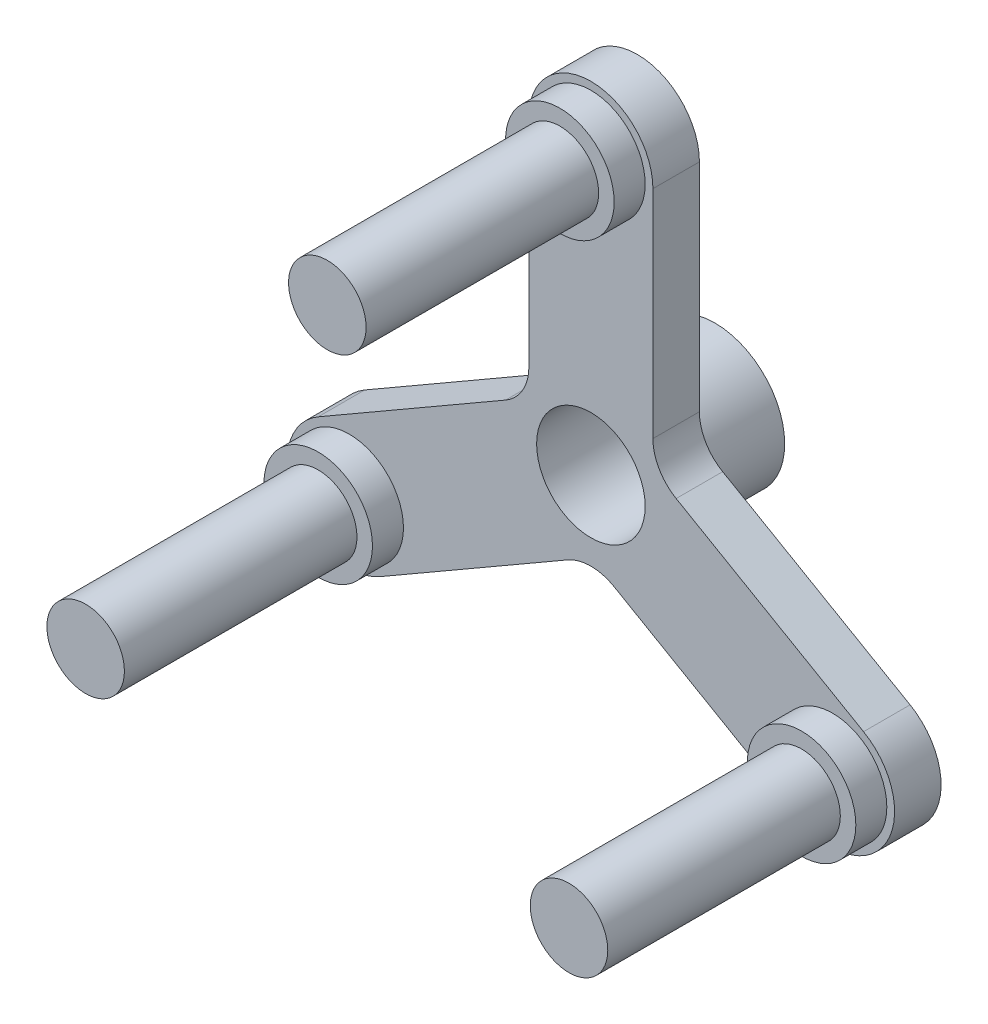
from build123d import *
from build123d.topology import SkipClean

# Parameters (mm, degrees)
SKETCH2_R           = 3.5
BOSS_EXTRUDE1_DEPTH = 3
SKETCH3_R           = 3.5
BOSS_EXTRUDE2_DEPTH = 2
SKETCH4_R           = 2.5
BOSS_EXTRUDE3_DEPTH = 15
CIRPATTERN1_COUNT   = 3
FILLET1_R           = 3
BOSS_EXTRUDE4_START = 5
SKETCH5_R           = 4.5
SKETCH5_R_2         = 3.5
BOSS_EXTRUDE4_DEPTH = 5


with BuildPart() as part:
    # Sketch2 → Boss-Extrude1 (new body)
    with BuildSketch(Plane.XY):
        with BuildLine():
            Line((-4, 0), (-4, 18))
            ThreePointArc((-4, 18), (0, 22), (4, 18))
            Line((4, 18), (4, 0))
            ThreePointArc((4, 0), (0, -4), (-4, 0))
        make_face()
        Circle(SKETCH2_R, mode=Mode.SUBTRACT)
    boss_extrude1 = extrude(amount=BOSS_EXTRUDE1_DEPTH)

    # Sketch3 → Boss-Extrude2 (add)
    with BuildSketch(Plane.XY.offset(3)):
        with Locations((0, 18)):
            Circle(SKETCH3_R)
    boss_extrude2 = extrude(amount=BOSS_EXTRUDE2_DEPTH)

    # Sketch4 → Boss-Extrude3 (add)
    with BuildSketch(Plane.XY.offset(5)):
        with Locations((0, 18)):
            Circle(SKETCH4_R)
    boss_extrude3 = extrude(amount=BOSS_EXTRUDE3_DEPTH)

    # CirPattern1: Boss-Extrude1, Boss-Extrude2, Boss-Extrude3 ×3 about axis
    cirpattern1_axis = Axis((0, 0, 0), (0, 0, 1))
    add([boss_extrude1.rotate(cirpattern1_axis, i * 360 / CIRPATTERN1_COUNT) for i in range(1, CIRPATTERN1_COUNT)])
    add([boss_extrude2.rotate(cirpattern1_axis, i * 360 / CIRPATTERN1_COUNT) for i in range(1, CIRPATTERN1_COUNT)])
    add([boss_extrude3.rotate(cirpattern1_axis, i * 360 / CIRPATTERN1_COUNT) for i in range(1, CIRPATTERN1_COUNT)])

    # Fillet1
    fillet1_edges = [part.edges().sort_by_distance(p)[0] for p in [
        (-4, 2.309401077, 1.5),
        (4, 2.309401077, 1.5),
        (0, -4.618802154, 1.5),
    ]]
    fillet(fillet1_edges, radius=FILLET1_R)

    # Sketch5 → Boss-Extrude4 (add)
    with SkipClean():  # the faces are left unmerged after this step: merging them gives an invalid solid
        with BuildSketch(Plane(origin=(0, 0, 0), x_dir=(-1, 0, 0), z_dir=(0, 0, -1)).offset(BOSS_EXTRUDE4_START)):
            with Locations(Location((0, 0, 0), (0, 0, 180))):
                Circle(SKETCH5_R)
            Circle(SKETCH5_R_2, mode=Mode.SUBTRACT)
        extrude(amount=-BOSS_EXTRUDE4_DEPTH)


solid = part.part
